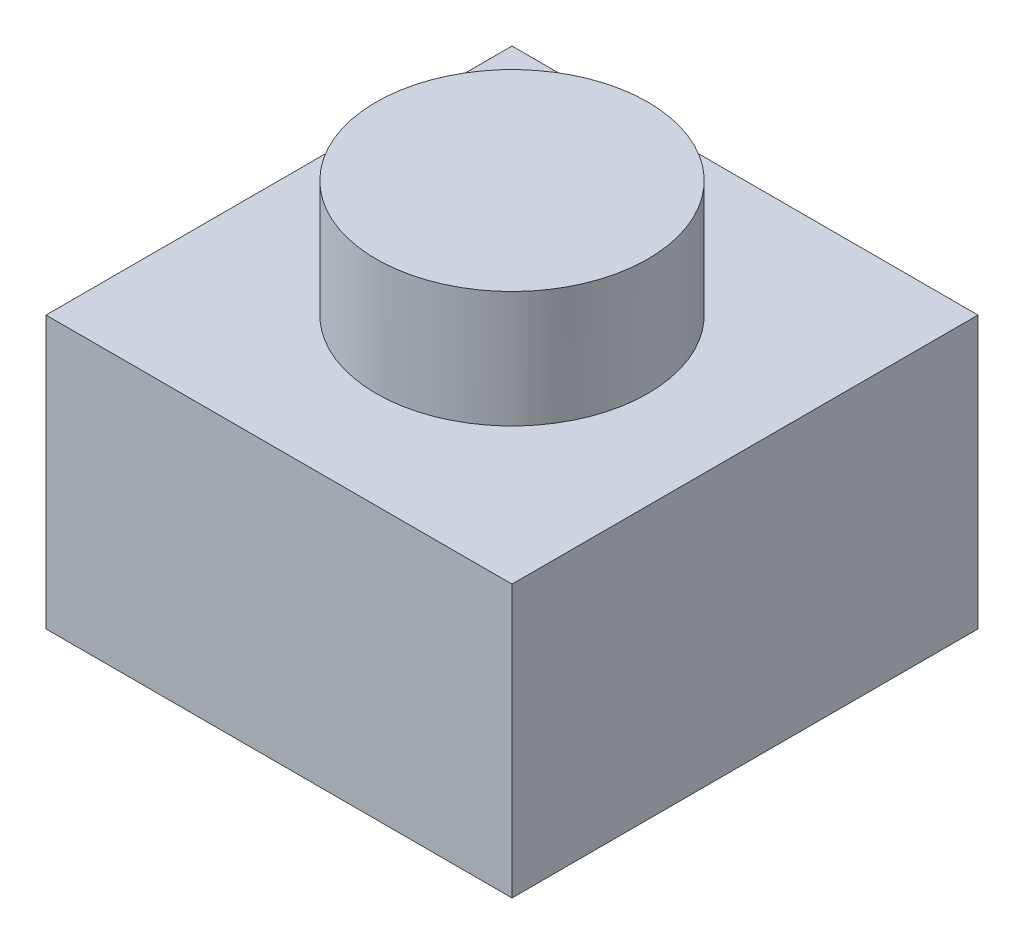
from build123d import *

# Parameters (mm, degrees)
SKETCH_1_W      = 6
SKETCH_1_H      = 6
EXTRUDE_1_DEPTH = 3.5
SKETCH_2_R      = 1.75
EXTRUDE_2_DEPTH = 5


with BuildPart() as part:
    # 草图1 → 凸台-拉伸1 (new body)
    with BuildSketch(Plane(origin=(0, 0, 0), x_dir=(1, 0, 0), z_dir=(0, 1, 0))):
        Rectangle(SKETCH_1_W, SKETCH_1_H)
    extrude(amount=EXTRUDE_1_DEPTH)

    # 草图2 → 凸台-拉伸2 (add)
    with BuildSketch(Plane.XZ):
        with Locations(Location((0, 0, 0), (0, 0, 270))):
            Circle(SKETCH_2_R)
    extrude(amount=-EXTRUDE_2_DEPTH)


solid = part.part
